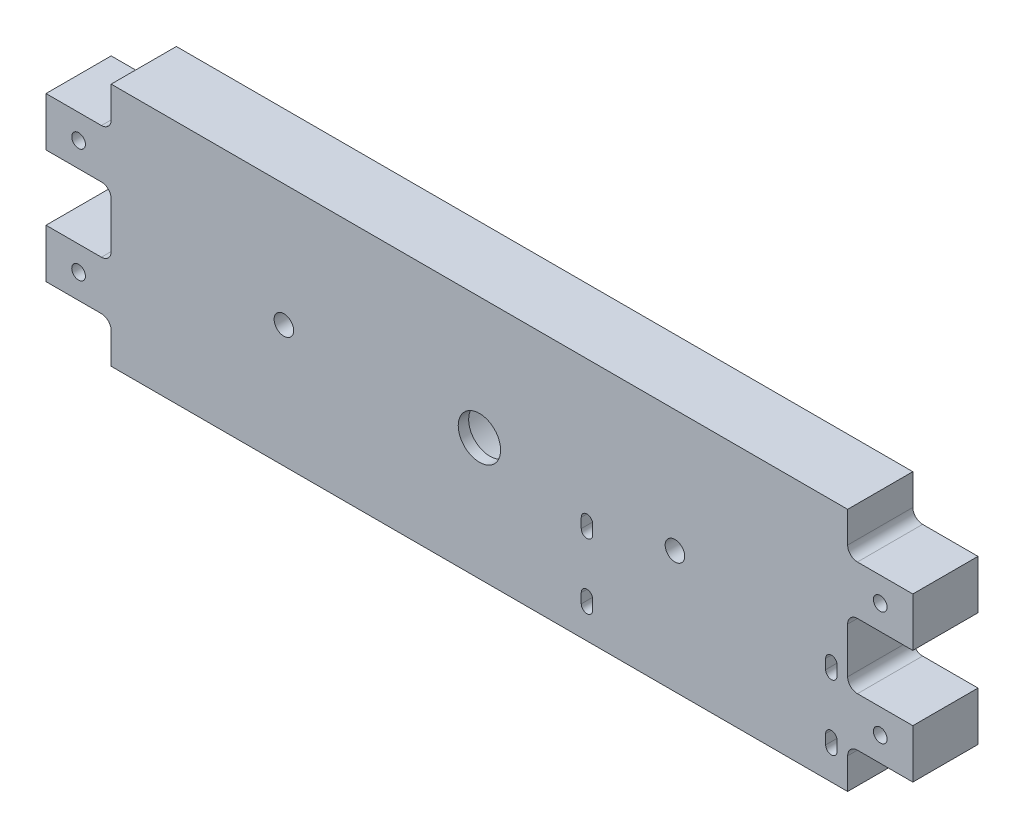
from build123d import *

# Parameters (mm, degrees)
SKIZZE1_W                        = 266
SKIZZE1_H                        = 80
AUFSATZ_LINEAR_AUSTRAGEN1_DEPTH  = 20
SKIZZE4_R                        = 6.5
SCHNITT_LINEAR_AUSTRAGEN1_DEPTH  = 20
SKIZZE9_R                        = 15
SCHNITT_LINEAR_AUSTRAGEN5_DEPTH  = 16.8
SKIZZE10_W                       = 20
SKIZZE10_H                       = 15
SCHNITT_LINEAR_AUSTRAGEN6_DEPTH  = 24.3
SKIZZE11_W                       = 91.383535354
SKIZZE11_H                       = 106.650454953
SKIZZE11_W_2                     = 30.220228655
SKIZZE11_H_2                     = 75
SCHNITT_LINEAR_AUSTRAGEN7_DEPTH  = 304.3
SKIZZE12_R                       = 24.75
SCHNITT_LINEAR_AUSTRAGEN8_DEPTH  = 3
SKIZZE13_W                       = 20
SKIZZE13_H                       = 20
SCHNITT_LINEAR_AUSTRAGEN10_DEPTH = 20
VERRUNDUNG1_R                    = 3
SKIZZE14_W                       = 20
SKIZZE14_H                       = 20
SCHNITT_LINEAR_AUSTRAGEN11_DEPTH = 20
VERRUNDUNG2_R                    = 3
SKIZZE15_R                       = 2
SCHNITT_LINEAR_AUSTRAGEN12_DEPTH = 20
M5_GEWINDEBOHRUNG1_D             = 4.2
M5_GEWINDEBOHRUNG1_CSINK_D       = 5.05
M5_GEWINDEBOHRUNG1_CSINK_ANGLE   = 90
SCHNITT_LINEAR_AUSTRAGEN13_DEPTH = 30
SCHNITT_LINEAR_AUSTRAGEN14_DEPTH = 6
SKIZZE19_R                       = 3
SCHNITT_LINEAR_AUSTRAGEN15_DEPTH = 20


with BuildPart() as part:
    # Skizze1 → Aufsatz-Linear austragen1 (new body)
    with BuildSketch(Plane.XY):
        with Locations((43.523698588, -6.755674232)):
            Rectangle(SKIZZE1_W, SKIZZE1_H)
    extrude(amount=AUFSATZ_LINEAR_AUSTRAGEN1_DEPTH)

    # Skizze4 → Schnitt-Linear austragen1 (cut)
    with BuildSketch(Plane(origin=(0, 0, 0), x_dir=(-1, 0, 0), z_dir=(0, 0, -1))):
        with Locations((-43.523698588, -6.755674232)):
            Circle(SKIZZE4_R)
    extrude(amount=-SCHNITT_LINEAR_AUSTRAGEN1_DEPTH, mode=Mode.SUBTRACT)

    # Skizze9 → Schnitt-Linear austragen5 (cut)
    with BuildSketch(Plane(origin=(0, 0, 0), x_dir=(-1, 0, 0), z_dir=(0, 0, -1))):
        with Locations((-43.523698588, -6.755674232)):
            Circle(SKIZZE9_R)
    extrude(amount=-SCHNITT_LINEAR_AUSTRAGEN5_DEPTH, mode=Mode.SUBTRACT)

    # Skizze10 → Schnitt-Linear austragen6 (cut)
    with BuildSketch(Plane.XY.offset(20)):
        with Locations((-79.476301412, 25.744325768)):
            Rectangle(SKIZZE10_W, SKIZZE10_H)
        with Locations((-79.476301412, -39.255674232)):
            Rectangle(SKIZZE10_W, SKIZZE10_H)
        with Locations((166.523698588, -39.255674232)):
            Rectangle(SKIZZE10_W, SKIZZE10_H)
        with Locations((166.523698588, 25.744325768)):
            Rectangle(SKIZZE10_W, SKIZZE10_H)
    extrude(amount=-SCHNITT_LINEAR_AUSTRAGEN6_DEPTH, mode=Mode.SUBTRACT)

    # Skizze11 → Schnitt-Linear austragen7 (cut)
    with BuildSketch(Plane.ZY.offset(89.476301412)):
        with Locations((10.152146704, -6.755674232)):
            Rectangle(SKIZZE11_W, SKIZZE11_H)
        with Locations((10.152146705, -6.755674232)):
            Rectangle(SKIZZE11_W_2, SKIZZE11_H_2, mode=Mode.SUBTRACT)
    extrude(amount=-SCHNITT_LINEAR_AUSTRAGEN7_DEPTH, mode=Mode.SUBTRACT)

    # Skizze12 → Schnitt-Linear austragen8 (cut)
    with BuildSketch(Plane(origin=(0, 0, 0), x_dir=(-1, 0, 0), z_dir=(0, 0, -1))):
        with Locations((-43.523698588, -6.755674232)):
            Circle(SKIZZE12_R)
    extrude(amount=-SCHNITT_LINEAR_AUSTRAGEN8_DEPTH, mode=Mode.SUBTRACT)

    # Skizze13 → Schnitt-Linear austragen10 (cut)
    with BuildSketch(Plane.ZY.offset(89.476301412)):
        with Locations((10, -6.755674232)):
            Rectangle(SKIZZE13_W, SKIZZE13_H)
    extrude(amount=-SCHNITT_LINEAR_AUSTRAGEN10_DEPTH, mode=Mode.SUBTRACT)

    # Verrundung1
    verrundung1_edges = [part.edges().sort_by_distance(p)[0] for p in [
        (-69.476301412, 3.244325768, 10),
        (-69.476301412, -16.755674232, 10),
        (-69.476301412, -31.755674232, 10),
        (-69.476301412, 18.244325768, 10),
    ]]
    fillet(verrundung1_edges, radius=VERRUNDUNG1_R)

    # Skizze14 → Schnitt-Linear austragen11 (cut)
    with BuildSketch(Plane(origin=(176.523698588, 0, 0), x_dir=(0, 0, -1), z_dir=(1, 0, 0))):
        with Locations((-10, -6.755674232)):
            Rectangle(SKIZZE14_W, SKIZZE14_H)
    extrude(amount=-SCHNITT_LINEAR_AUSTRAGEN11_DEPTH, mode=Mode.SUBTRACT)

    # Verrundung2
    verrundung2_edges = [part.edges().sort_by_distance(p)[0] for p in [
        (156.523698588, 3.244325768, 10),
        (156.523698588, -16.755674232, 10),
        (156.523698588, 18.244325768, 10),
        (156.523698588, -31.755674232, 10),
    ]]
    fillet(verrundung2_edges, radius=VERRUNDUNG2_R)

    # Skizze15 → Schnitt-Linear austragen12 (cut)
    with BuildSketch(Plane(origin=(0, 0, 0), x_dir=(-1, 0, 0), z_dir=(0, 0, -1))):
        with Locations((79.476301412, 10.744325768)):
            Circle(SKIZZE15_R)
        with Locations((79.476301412, -24.255674232)):
            Circle(SKIZZE15_R)
        with Locations((-166.523698588, 10.744325768)):
            Circle(SKIZZE15_R)
        with Locations((-166.523698588, -24.255674232)):
            Circle(SKIZZE15_R)
    extrude(amount=-SCHNITT_LINEAR_AUSTRAGEN12_DEPTH, mode=Mode.SUBTRACT)

    # M5 Gewindebohrung1 (through all)
    with Locations(Plane(origin=(166.523698588, 10.744325768, 0), x_dir=(-1, 0, 0), z_dir=(0, 0, -1))):
        with Locations((0, 0), (0, -35), (246, 0), (246, -35)):
            CounterSinkHole(M5_GEWINDEBOHRUNG1_D / 2, M5_GEWINDEBOHRUNG1_CSINK_D / 2, counter_sink_angle=M5_GEWINDEBOHRUNG1_CSINK_ANGLE)

    # Skizze17 → Schnitt-Linear austragen13 (cut)
    with BuildSketch(Plane(origin=(0, 0, 0), x_dir=(-1, 0, 0), z_dir=(0, 0, -1))):
        with BuildLine():
            Line((-149.773698588, -12.255674232), (-149.773698588, -15.255674232))
            ThreePointArc((-149.773698588, -15.255674232), (-151.523698588, -17.005674232), (-153.273698588, -15.255674232))
            Line((-153.273698588, -15.255674232), (-153.273698588, -12.255674232))
            ThreePointArc((-153.273698588, -12.255674232), (-151.523698588, -10.505674232), (-149.773698588, -12.255674232))
        make_face()
        with BuildLine():
            Line((-74.773698588, -12.255674232), (-74.773698588, -15.255674232))
            ThreePointArc((-74.773698588, -15.255674232), (-76.523698588, -17.005674232), (-78.273698588, -15.255674232))
            Line((-78.273698588, -15.255674232), (-78.273698588, -12.255674232))
            ThreePointArc((-78.273698588, -12.255674232), (-76.523698588, -10.505674232), (-74.773698588, -12.255674232))
        make_face()
        with BuildLine():
            Line((-74.773698588, -32.255674232), (-74.773698588, -35.255674232))
            ThreePointArc((-74.773698588, -35.255674232), (-76.523698588, -37.005674232), (-78.273698588, -35.255674232))
            Line((-78.273698588, -35.255674232), (-78.273698588, -32.255674232))
            ThreePointArc((-78.273698588, -32.255674232), (-76.523698588, -30.505674232), (-74.773698588, -32.255674232))
        make_face()
        with BuildLine():
            Line((-149.773698588, -32.255674232), (-149.773698588, -35.255674232))
            ThreePointArc((-149.773698588, -35.255674232), (-151.523698588, -37.005674232), (-153.273698588, -35.255674232))
            Line((-153.273698588, -35.255674232), (-153.273698588, -32.255674232))
            ThreePointArc((-153.273698588, -32.255674232), (-151.523698588, -30.505674232), (-149.773698588, -32.255674232))
        make_face()
    extrude(amount=-SCHNITT_LINEAR_AUSTRAGEN13_DEPTH, mode=Mode.SUBTRACT)

    # Skizze18 → Schnitt-Linear austragen14 (cut)
    with BuildSketch(Plane(origin=(0, 0, 0), x_dir=(-1, 0, 0), z_dir=(0, 0, -1))):
        with BuildLine():
            Line((-148.523698588, -9.718914621), (-148.523698588, -18.718914621))
            ThreePointArc((-148.523698588, -18.718914621), (-151.523698588, -21.718914621), (-154.523698588, -18.718914621))
            Line((-154.523698588, -18.718914621), (-154.523698588, -9.718914621))
            ThreePointArc((-154.523698588, -9.718914621), (-151.523698588, -6.718914621), (-148.523698588, -9.718914621))
        make_face()
        with BuildLine():
            Line((-148.523698588, -29.255674232), (-148.523698588, -38.255674232))
            ThreePointArc((-148.523698588, -38.255674232), (-151.523698588, -41.255674232), (-154.523698588, -38.255674232))
            Line((-154.523698588, -38.255674232), (-154.523698588, -29.255674232))
            ThreePointArc((-154.523698588, -29.255674232), (-151.523698588, -26.255674232), (-148.523698588, -29.255674232))
        make_face()
        with BuildLine():
            Line((-73.523698588, -9.255674232), (-73.523698588, -18.255674232))
            ThreePointArc((-73.523698588, -18.255674232), (-76.523698588, -21.255674232), (-79.523698588, -18.255674232))
            Line((-79.523698588, -18.255674232), (-79.523698588, -9.255674232))
            ThreePointArc((-79.523698588, -9.255674232), (-76.523698588, -6.255674232), (-73.523698588, -9.255674232))
        make_face()
        with BuildLine():
            Line((-73.523698588, -29.255674232), (-73.523698588, -38.255674232))
            ThreePointArc((-73.523698588, -38.255674232), (-76.523698588, -41.255674232), (-79.523698588, -38.255674232))
            Line((-79.523698588, -38.255674232), (-79.523698588, -29.255674232))
            ThreePointArc((-79.523698588, -29.255674232), (-76.523698588, -26.255674232), (-73.523698588, -29.255674232))
        make_face()
    extrude(amount=-SCHNITT_LINEAR_AUSTRAGEN14_DEPTH, mode=Mode.SUBTRACT)

    # Skizze19 → Schnitt-Linear austragen15 (cut)
    with BuildSketch(Plane(origin=(0, 0, 0), x_dir=(-1, 0, 0), z_dir=(0, 0, -1))):
        with Locations((16.476301412, -6.755674232)):
            Circle(SKIZZE19_R)
        with Locations((-103.523698588, -6.755674232)):
            Circle(SKIZZE19_R)
    extrude(amount=-SCHNITT_LINEAR_AUSTRAGEN15_DEPTH, mode=Mode.SUBTRACT)


solid = part.part
